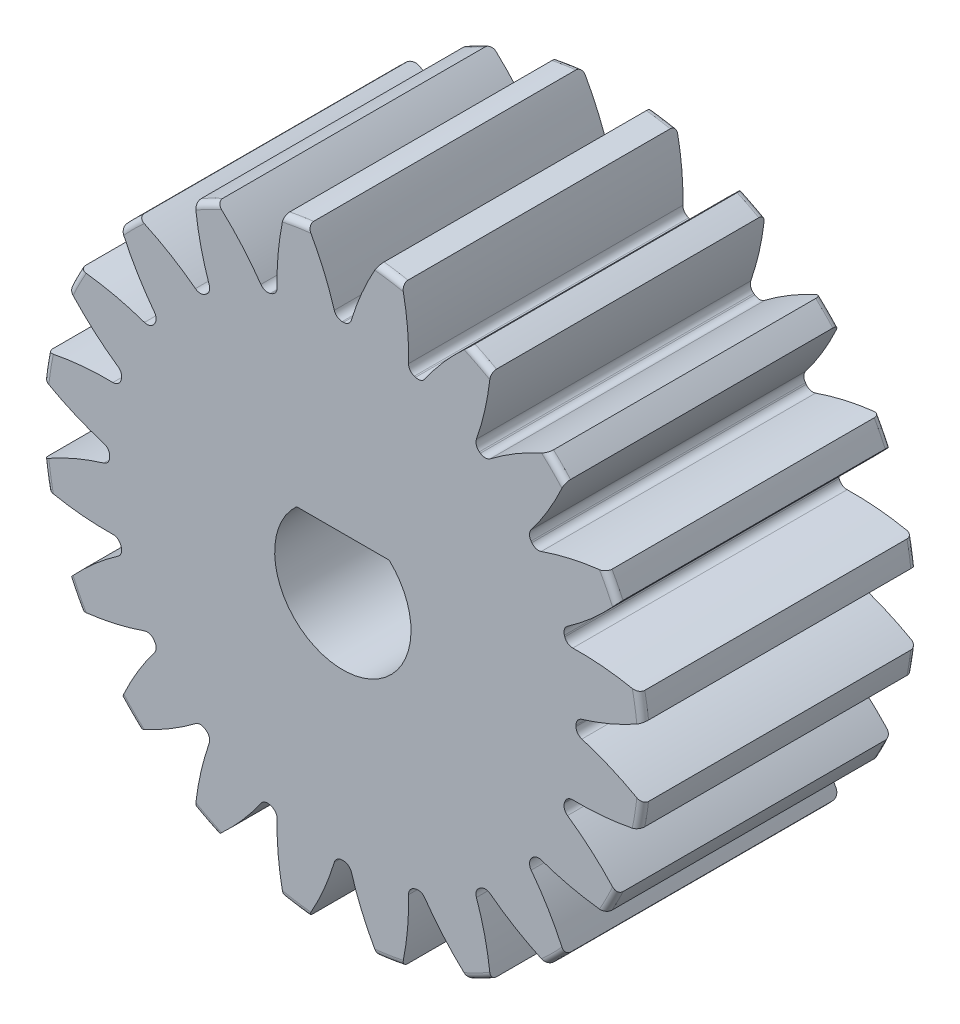
from build123d import *

# Parameters (mm, degrees)
FILLET2_R           = 0.2794
CUT_EXTRUDE2_DEPTH  = 24.486417411
CIRPATTERN1_COUNT   = 20
SKETCH11_R          = 11.43
CUT_EXTRUDE3_DEPTH  = 11.1252
SKETCH13_R          = 6.35
BOSS_EXTRUDE1_DEPTH = 12.7
SKETCH15_R          = 6.35
CUT_EXTRUDE4_DEPTH  = 6.35
CUT_EXTRUDE5_DEPTH  = 24.372927403


with BuildPart() as part:
    # Sketch4 → Revolve1 (revolve)
    with BuildSketch(Plane(origin=(0, 0, 0), x_dir=(0, 0, -1), z_dir=(1, 0, 0))):
        Polygon((-23.8252, 6.35), (-23.8252, 10.8331), (-12.7, 10.8331), (-12.7, 13.97), (0, 13.97), (0, 6.35), align=None)
    revolve(axis=Axis((0, 0, 12.7), (0, 0, 1)))

    # Fillet2
    fillet2_edges = [part.edges().sort_by_distance(p)[0] for p in [
        (0, -13.97, 0),
        (0, -13.97, 12.7),
        (0, -10.8331, 12.7),
        (0, -10.8331, 23.8252),
    ]]
    fillet(fillet2_edges, radius=FILLET2_R)

    # Sketch7 → Cut-Extrude2 (cut, through all)
    with BuildSketch(Plane.XY.offset(12.7)):
        with BuildLine():
            ThreePointArc((-0.029449487, 10.79495983), (0, 10.795), (0.029449487, 10.79495983))
            ThreePointArc((0.029449487, 10.79495983), (0.257238629, 10.869772623), (0.395246272, 11.06583062))
            ThreePointArc((0.395246272, 11.06583062), (0.92781573, 12.507614405), (1.630655191, 13.874504087))
            ThreePointArc((1.630655191, 13.874504087), (0, 13.97), (-1.630655191, 13.874504087))
            ThreePointArc((-1.630655191, 13.874504087), (-0.92781573, 12.507614405), (-0.395246272, 11.06583062))
            ThreePointArc((-0.395246272, 11.06583062), (-0.257238629, 10.869772623), (-0.029449487, 10.79495983))
        make_face()
    cut_extrude2 = extrude(amount=-CUT_EXTRUDE2_DEPTH, mode=Mode.SUBTRACT)

    # CirPattern1: Cut-Extrude2 ×20 about axis
    cirpattern1_axis = Axis((0, 0, 0), (0, 0, 1))
    for i in range(1, CIRPATTERN1_COUNT):
        add(cut_extrude2.rotate(cirpattern1_axis, i * 360 / CIRPATTERN1_COUNT), mode=Mode.SUBTRACT)

    # Sketch11 → Cut-Extrude3 (cut)
    with BuildSketch(Plane.XY.offset(23.8252)):
        Circle(SKETCH11_R)
    extrude(amount=-CUT_EXTRUDE3_DEPTH, mode=Mode.SUBTRACT)

    # Sketch13 → Boss-Extrude1 (add)
    with BuildSketch(Plane.XY.offset(12.7)):
        Circle(SKETCH13_R)
    extrude(amount=-BOSS_EXTRUDE1_DEPTH)

    # Sketch15 → Cut-Extrude4 (cut)
    with BuildSketch(Plane(origin=(0, 0, 0), x_dir=(-1, 0, 0), z_dir=(0, 0, -1))):
        with Locations(Location((0, 0, 0), (0, 0, 90))):
            Circle(SKETCH15_R)
    extrude(amount=-CUT_EXTRUDE4_DEPTH, mode=Mode.SUBTRACT)

    # Sketch16 → Cut-Extrude5 (cut, through all)
    with BuildSketch(Plane.XY.offset(12.7)):
        with BuildLine():
            ThreePointArc((-2.141974636, 2.31775), (-2.938938883, -1.150068974), (0, -3.15595))
            Line((0, -3.15595), (0, 2.31775))
            Line((0, 2.31775), (-2.141974636, 2.31775))
        make_face()
        with BuildLine():
            Line((0, 2.31775), (0, -3.15595))
            ThreePointArc((0, -3.15595), (2.231593646, -2.231593646), (3.15595, 0))
            ThreePointArc((3.15595, 0), (2.891365184, 1.264922043), (2.141974636, 2.31775))
            Line((2.141974636, 2.31775), (0, 2.31775))
        make_face()
    extrude(amount=-CUT_EXTRUDE5_DEPTH, mode=Mode.SUBTRACT)


solid = part.part
